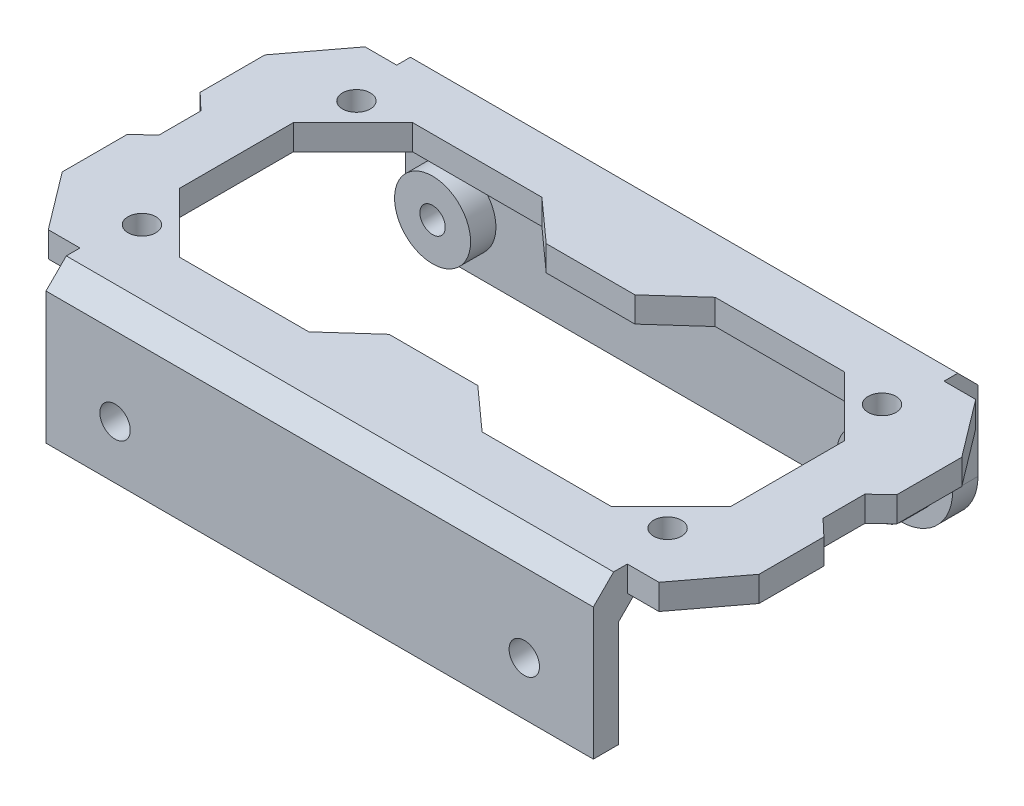
from build123d import *
from build123d.topology import SkipClean

# Parameters (mm, degrees)
EXTRUDE_1_DEPTH     = 2
SKETCH_2_R          = 1.1
CUT_EXTRUDE_1_DEPTH = 2
SKETCH_3_W          = 43.2
SKETCH_3_H          = 2
EXTRUDE_2_DEPTH     = 10
SKETCH_4_R          = 1
CUT_EXTRUDE_2_DEPTH = 2
SKETCH_5_R          = 3
SKETCH_5_R_2        = 1
EXTRUDE_3_DEPTH     = 2
CHAMFER_2_SIZE      = 1.6
CUT_EXTRUDE_3_DEPTH = 5.9
CUT_EXTRUDE_4_DEPTH = 5.9
SKETCH_9_R          = 1.2
CUT_EXTRUDE_5_DEPTH = 10
CUT_EXTRUDE_7_DEPTH = 10


with BuildPart() as part:
    # 草图1 → 凸台-拉伸1 (new body)
    with BuildSketch(Plane(origin=(0, 0, 0), x_dir=(1, 0, 0), z_dir=(0, 1, 0))):
        Polygon((24.1, -12.5), (27.5, -8), (27.5, -2.885), (26.2, -1.65), (26.2, 1.65), (27.5, 2.885), (27.5, 8), (24.1, 12.5), (21.6, 12.5), (21.6, 15.18), (-21.6, 15.18), (-21.6, 12.5), (-24.1, 12.5), (-27.5, 8), (-27.5, 2.885), (-26.2, 1.65), (-26.2, -1.65), (-27.5, -2.885), (-27.5, -8), (-24.1, -12.5), (-21.6, -12.5), (-21.6, -15.18), (21.6, -15.18), (21.6, -12.5), align=None)
        Polygon((17.05, -9.2), (6.84, -9.2), (3.5, -6.2), (-3.5, -6.2), (-6.84, -9.2), (-17.05, -9.2), (-21.75, -4.5), (-21.75, 4.5), (-17.05, 9.2), (-6.84, 9.2), (-3.5, 6.2), (3.5, 6.2), (6.84, 9.2), (17.05, 9.2), (21.75, 4.5), (21.75, -4.5), align=None, mode=Mode.SUBTRACT)
    extrude(amount=EXTRUDE_1_DEPTH)

    # 草图2 → 切除-拉伸1 (cut)
    with BuildSketch(Plane(origin=(0, 2, 0), x_dir=(1, 0, 0), z_dir=(0, 1, 0))):
        with Locations(Location((20.742981447, -8.464435144, 0), (0, 0, 270))):
            Circle(SKETCH_2_R)
        with Locations(Location((-20.742981447, 8.464435144, 0), (0, 0, 270))):
            Circle(SKETCH_2_R)
        with BuildLine():
            Line((21.75, 8.021813823), (21.75, 8.907056465))
            ThreePointArc((21.75, 8.907056465), (21.667117231, 9.061069917), (21.560871624, 9.2))
            Line((21.560871624, 9.2), (21.354867257, 9.2))
            Line((21.354867257, 9.2), (21.446447919, 9.310091648))
            ThreePointArc((21.446447919, 9.310091648), (19.672301899, 8.21215493), (21.75, 8.021813823))
        make_face()
        with Locations(Location((-20.742981447, -8.464435144, 0), (0, 0, 270))):
            Circle(SKETCH_2_R)
    extrude(amount=-CUT_EXTRUDE_1_DEPTH, mode=Mode.SUBTRACT)

    # 草图3 → 凸台-拉伸2 (add)
    with BuildSketch(Plane.XZ):
        with Locations((0, -14.18)):
            Rectangle(SKETCH_3_W, SKETCH_3_H)
        with Locations((0, 14.18)):
            Rectangle(SKETCH_3_W, SKETCH_3_H)
    extrude(amount=EXTRUDE_2_DEPTH)

    # 草图4 → 切除-拉伸2 (cut)
    with BuildSketch(Plane(origin=(0, 0, -15.18), x_dir=(-1, 0, 0), z_dir=(0, 0, -1))):
        with Locations((-17.45, -5.85)):
            Circle(SKETCH_4_R)
        with BuildLine():
            ThreePointArc((-17.45, -10), (-20.384493142, -8.784493142), (-21.6, -5.85))
            Line((-21.6, -5.85), (-21.6, -10))
            Line((-21.6, -10), (-17.45, -10))
        make_face()
        with Locations((17.45, -5.85)):
            Circle(SKETCH_4_R)
        with BuildLine():
            Line((21.6, -10), (21.6, -5.85))
            ThreePointArc((21.6, -5.85), (20.384493142, -8.784493142), (17.45, -10))
            Line((17.45, -10), (21.6, -10))
        make_face()
    extrude(amount=-CUT_EXTRUDE_2_DEPTH, mode=Mode.SUBTRACT)

    # 草图5 → 凸台-拉伸3 (add)
    # profile 1 of 2: a face of its own
    with BuildSketch(Plane.XY.offset(-13.18)):
        with Locations(Location((17.45, -5.85, 0), (0, 0, 180))):
            Circle(SKETCH_5_R)
        with Locations(Location((17.45, -5.85, 0), (0, 0, 180))):
            Circle(SKETCH_5_R_2, mode=Mode.SUBTRACT)
    # profile 2 of 2: a face of its own
    with BuildSketch(Plane.XY.offset(-13.18)):
        with Locations(Location((-17.45, -5.85, 0), (0, 0, 180))):
            Circle(SKETCH_5_R)
        with Locations(Location((-17.45, -5.85, 0), (0, 0, 180))):
            Circle(SKETCH_5_R_2, mode=Mode.SUBTRACT)
    extrude(amount=EXTRUDE_3_DEPTH)

    # 倒角2
    chamfer_2_edges = [part.edges().sort_by_distance(p)[0] for p in [
        (0, 2, 15.18),
        (0, 0, 13.18),
        (0, 0, -13.18),
        (0, 2, -15.18),
    ]]
    chamfer(chamfer_2_edges, length=CHAMFER_2_SIZE)

    # 草图7 → 切除-拉伸3 (cut)
    with BuildSketch(Plane(origin=(21.6, 0, 0), x_dir=(0, 0, -1), z_dir=(1, 0, 0))):
        Polygon((-12.5, -0.92), (-11.58, 0), (-12.5, 0), align=None)
        Polygon((12.5, 0), (11.58, 0), (12.5, -0.92), align=None)
    extrude(amount=CUT_EXTRUDE_3_DEPTH, mode=Mode.SUBTRACT)

    # 草图8 → 切除-拉伸4 (cut)
    with BuildSketch(Plane.ZY.offset(27.5)):
        Polygon((12.5, 0), (11.58, 0), (12.5, -0.92), align=None)
        Polygon((-12.5, -0.92), (-11.58, 0), (-12.5, 0), align=None)
    extrude(amount=-CUT_EXTRUDE_4_DEPTH, mode=Mode.SUBTRACT)

    # 草图9 → 切除-拉伸5 (cut)
    with BuildSketch(Plane.XY.offset(15.18)):
        with Locations((-16.15, -5.8)):
            Circle(SKETCH_9_R)
        with Locations((16.15, -5.8)):
            Circle(SKETCH_9_R)
    extrude(amount=-CUT_EXTRUDE_5_DEPTH, mode=Mode.SUBTRACT)

    # 草图11 → 切除-拉伸7 (cut)
    with SkipClean():  # the faces are left unmerged after this step: merging them gives an invalid solid
        with BuildSketch(Plane(origin=(0, 2, 0), x_dir=(1, 0, 0), z_dir=(0, 1, 0))):
            with BuildLine():
                Line((21.446447919, 9.310091648), (21.354867257, 9.2))
                Line((21.354867257, 9.2), (21.560871624, 9.2))
                ThreePointArc((21.560871624, 9.2), (21.667117231, 9.061069917), (21.75, 8.907056465))
                Line((21.75, 8.907056465), (21.75, 8.021813823))
                ThreePointArc((21.75, 8.021813823), (19.672301899, 8.21215493), (21.446447919, 9.310091648))
            make_face()
            with BuildLine():
                Line((21.75, 8.907056465), (21.75, 8.021813823))
                ThreePointArc((21.75, 8.021813823), (21.819485141, 8.238294047), (21.842981447, 8.464435144))
                ThreePointArc((21.842981447, 8.464435144), (21.819485141, 8.690576241), (21.75, 8.907056465))
            make_face()
            with BuildLine():
                ThreePointArc((21.560871624, 9.2), (21.505648843, 9.257113164), (21.446447919, 9.310091648))
                Line((21.446447919, 9.310091648), (21.354867257, 9.2))
                Line((21.354867257, 9.2), (21.560871624, 9.2))
            make_face()
        extrude(amount=-CUT_EXTRUDE_7_DEPTH, mode=Mode.SUBTRACT)


solid = part.part
